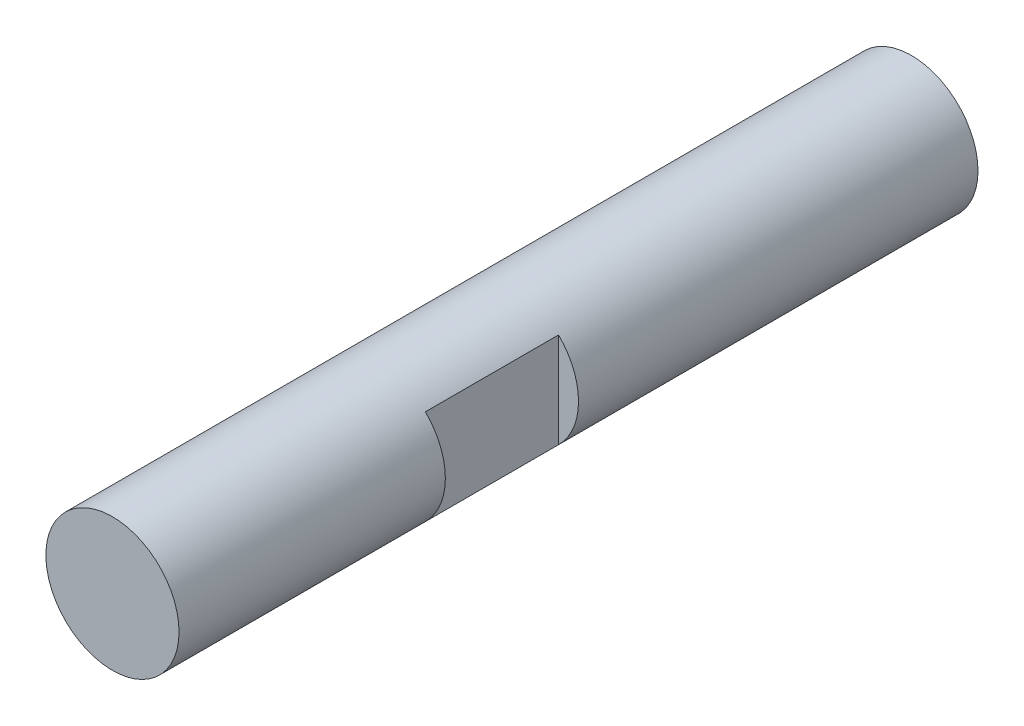
from build123d import *

# Parameters (mm, degrees)
SKETCH1_R           = 6.35
BOSS_EXTRUDE1_DEPTH = 38.1
BOSS_EXTRUDE2_DEPTH = 12.7
SKETCH3_R           = 6.35
BOSS_EXTRUDE3_DEPTH = 25.4


with BuildPart() as part:
    # Sketch1 → Boss-Extrude1 (new body)
    with BuildSketch(Plane.XY):
        with Locations(Location((0, 0, 0), (0, 0, 180))):
            Circle(SKETCH1_R)
    extrude(amount=BOSS_EXTRUDE1_DEPTH)

    # Sketch2 → Boss-Extrude2 (add)
    with BuildSketch(Plane.XY.offset(38.1)):
        with BuildLine():
            Line((-4.445, -4.534807052), (4.445, -4.534807052))
            Line((4.445, -4.534807052), (4.445, 4.534807052))
            ThreePointArc((4.445, 4.534807052), (-4.534807052, 4.445), (-4.445, -4.534807052))
        make_face()
    extrude(amount=BOSS_EXTRUDE2_DEPTH)

    # Sketch3 → Boss-Extrude3 (add)
    with BuildSketch(Plane.XY.offset(50.8)):
        Circle(SKETCH3_R)
    extrude(amount=BOSS_EXTRUDE3_DEPTH)


solid = part.part
